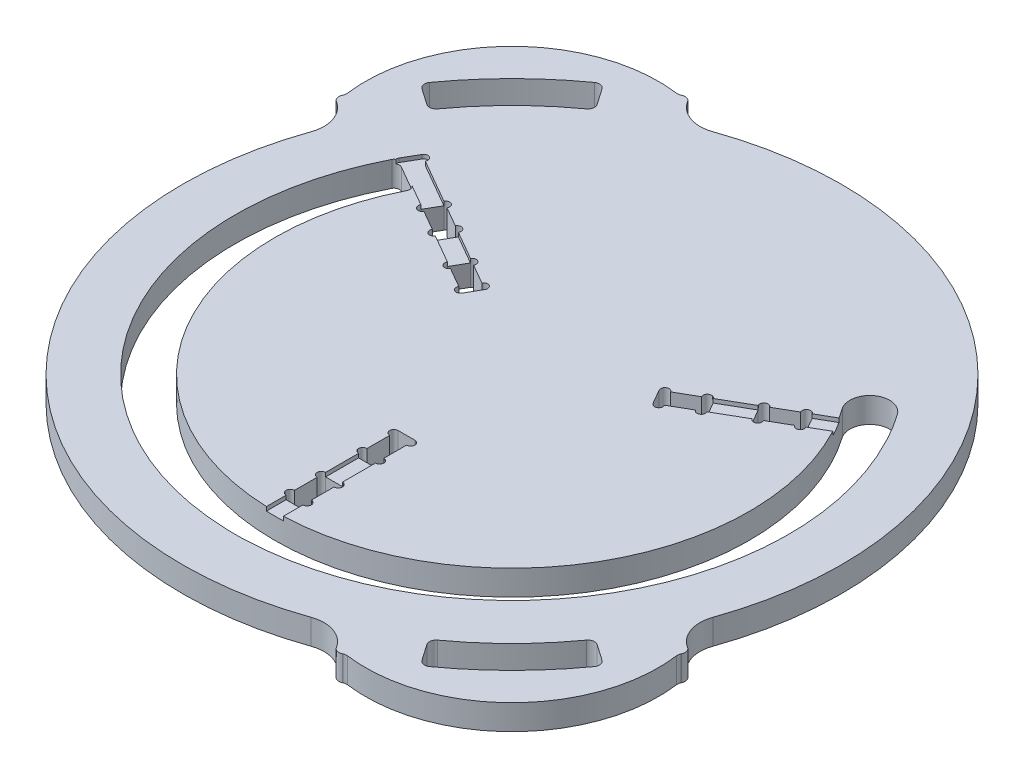
from build123d import *

# Parameters (mm, degrees)
BOSS_EXTRUDE1_DEPTH = 19.05
FILLET1_R           = 4
FILLET2_R           = 5
FILLET3_R           = 25
CUT_EXTRUDE1_DEPTH  = 355.066240418
CIRPATTERN1_COUNT   = 3
CUT_EXTRUDE2_DEPTH  = 3
CIRPATTERN2_COUNT   = 3


with BuildPart() as part:
    # Sketch1 → Boss-Extrude1 (new body)
    with BuildSketch(Plane(origin=(0, 0, 0), x_dir=(1, 0, 0), z_dir=(0, 1, 0))):
        with BuildLine():
            Line((-227.272727273, 104.149447613), (-250, 114.564392374))
            ThreePointArc((-250, 114.564392374), (-248.532464969, 117.714119188), (-247.02524875, 120.845051532))
            ThreePointArc((-247.02524875, 120.845051532), (-215.667568262, 215.667568262), (-120.845051532, 247.02524875))
            ThreePointArc((-120.845051532, 247.02524875), (-117.714119188, 248.532464969), (-114.564392374, 250))
            Line((-114.564392374, 250), (-104.149447613, 227.272727273))
            ThreePointArc((-104.149447613, 227.272727273), (176.776695297, 176.776695297), (227.272727273, -104.149447613))
            Line((227.272727273, -104.149447613), (250, -114.564392374))
            ThreePointArc((250, -114.564392374), (248.532464969, -117.714119188), (247.02524875, -120.845051532))
            ThreePointArc((247.02524875, -120.845051532), (215.667568262, -215.667568262), (120.845051532, -247.02524875))
            ThreePointArc((120.845051532, -247.02524875), (117.714119188, -248.532464969), (114.564392374, -250))
            Line((114.564392374, -250), (104.149447613, -227.272727273))
            ThreePointArc((104.149447613, -227.272727273), (-176.776695297, -176.776695297), (-227.272727273, 104.149447613))
        make_face()
        with BuildLine():
            Line((-184.957172187, 99.452724732), (-158.962541623, 84.444717779))
            ThreePointArc((-158.962541623, 84.444717779), (11.354398907, -179.641525337), (147.065162732, 103.787465094))
            ThreePointArc((147.065162732, 103.787465094), (152.575062256, 124.350690065), (173.138287227, 118.84079054))
            ThreePointArc((173.138287227, 118.84079054), (11.353227927, -209.692880698), (-184.957172187, 99.452724732))
        make_face(mode=Mode.SUBTRACT)
        with BuildLine():
            Line((-226.125782355, 156.499618384), (-205.56889305, 142.272380349))
            ThreePointArc((-205.56889305, 142.272380349), (-191.949665719, 160.172799908), (-176.776695297, 176.776695297))
            ThreePointArc((-176.776695297, 176.776695297), (-160.172799908, 191.949665719), (-142.272380349, 205.56889305))
            Line((-142.272380349, 205.56889305), (-156.499618384, 226.125782355))
            ThreePointArc((-156.499618384, 226.125782355), (-194.454364826, 194.454364826), (-226.125782355, 156.499618384))
        make_face(mode=Mode.SUBTRACT)
        with BuildLine():
            Line((156.499618384, -226.125782355), (142.272380349, -205.56889305))
            ThreePointArc((142.272380349, -205.56889305), (160.172799908, -191.949665719), (176.776695297, -176.776695297))
            ThreePointArc((176.776695297, -176.776695297), (191.949665719, -160.172799908), (205.56889305, -142.272380349))
            Line((205.56889305, -142.272380349), (226.125782355, -156.499618384))
            ThreePointArc((226.125782355, -156.499618384), (194.454364826, -194.454364826), (156.499618384, -226.125782355))
        make_face(mode=Mode.SUBTRACT)
    extrude(amount=BOSS_EXTRUDE1_DEPTH)

    # Fillet1
    fillet1_edges = [part.edges().sort_by_distance(p)[0] for p in [
        (-158.962541623, 9.525, -84.444717779),
        (-184.957172187, 9.525, -99.452724732),
    ]]
    fillet(fillet1_edges, radius=FILLET1_R)

    # Fillet2
    fillet2_edges = [part.edges().sort_by_distance(p)[0] for p in [
        (-114.564392374, 9.525, -250),
        (250, 9.525, 114.564392374),
        (247.02524875, 9.525, 120.845051532),
        (120.845051532, 9.525, 247.02524875),
        (114.564392374, 9.525, 250),
        (-250, 9.525, -114.564392374),
        (-247.02524875, 9.525, -120.845051532),
        (-120.845051532, 9.525, -247.02524875),
        (-205.56889305, 9.525, -142.272380349),
        (-142.272380349, 9.525, -205.56889305),
        (-156.499618384, 9.525, -226.125782355),
        (-226.125782355, 9.525, -156.499618384),
        (205.56889305, 9.525, 142.272380349),
        (142.272380349, 9.525, 205.56889305),
        (156.499618384, 9.525, 226.125782355),
        (226.125782355, 9.525, 156.499618384),
    ]]
    fillet(fillet2_edges, radius=FILLET2_R)

    # Fillet3
    fillet3_edges = [part.edges().sort_by_distance(p)[0] for p in [
        (-104.149447613, 9.525, -227.272727273),
        (-227.272727273, 9.525, -104.149447613),
        (104.149447613, 9.525, 227.272727273),
        (227.272727273, 9.525, 104.149447613),
    ]]
    fillet(fillet3_edges, radius=FILLET3_R)

    # Sketch3 → Cut-Extrude1 (cut, through all)
    with BuildSketch(Plane(origin=(0, 19.05, 0), x_dir=(1, 0, 0), z_dir=(0, 1, 0))):
        with BuildLine():
            Line((-6.4, -135), (6.4, -135))
            ThreePointArc((6.4, -135), (9.6, -138.2), (6.4, -141.4))
            Line((6.4, -141.4), (6.4, -158.6))
            ThreePointArc((6.4, -158.6), (9.6, -161.8), (6.4, -165))
            Line((6.4, -165), (-6.4, -165))
            ThreePointArc((-6.4, -165), (-9.6, -161.8), (-6.4, -158.6))
            Line((-6.4, -158.6), (-6.4, -141.4))
            ThreePointArc((-6.4, -141.4), (-9.6, -138.2), (-6.4, -135))
        make_face()
        with BuildLine():
            Line((-6.4, -80), (6.4, -80))
            ThreePointArc((6.4, -80), (9.6, -83.2), (6.4, -86.4))
            Line((6.4, -86.4), (6.4, -103.6))
            ThreePointArc((6.4, -103.6), (9.6, -106.8), (6.4, -110))
            Line((6.4, -110), (-6.4, -110))
            ThreePointArc((-6.4, -110), (-9.6, -106.8), (-6.4, -103.6))
            Line((-6.4, -103.6), (-6.4, -86.4))
            ThreePointArc((-6.4, -86.4), (-9.6, -83.2), (-6.4, -80))
        make_face()
    cut_extrude1 = extrude(amount=-CUT_EXTRUDE1_DEPTH, mode=Mode.SUBTRACT)

    # CirPattern1: Cut-Extrude1 ×3 about axis
    cirpattern1_axis = Axis((0, 0, 0), (0, 1, 0))
    for i in range(1, CIRPATTERN1_COUNT):
        add(cut_extrude1.rotate(cirpattern1_axis, i * 360 / CIRPATTERN1_COUNT), mode=Mode.SUBTRACT)

    # Sketch4 → Cut-Extrude2 (cut)
    with BuildSketch(Plane(origin=(0, 19.05, 0), x_dir=(1, 0, 0), z_dir=(0, 1, 0))):
        with BuildLine():
            Line((185.065334795, 99.457437416), (178.665334795, 110.542562584))
            ThreePointArc((178.665334795, 110.542562584), (174.294053503, 111.713843876), (173.122772211, 107.342562584))
            Line((173.122772211, 107.342562584), (66.082032303, 45.542562584))
            Line((66.082032303, 45.542562584), (72.482032303, 34.457437416))
            Line((72.482032303, 34.457437416), (179.522772211, 96.257437416))
            ThreePointArc((179.522772211, 96.257437416), (183.894053503, 95.086156124), (185.065334795, 99.457437416))
        make_face()
    cut_extrude2 = extrude(amount=-CUT_EXTRUDE2_DEPTH, mode=Mode.SUBTRACT)

    # CirPattern2: Cut-Extrude2 ×3 about axis
    cirpattern2_axis = Axis((0, 0, 0), (0, 1, 0))
    for i in range(1, CIRPATTERN2_COUNT):
        add(cut_extrude2.rotate(cirpattern2_axis, i * 360 / CIRPATTERN2_COUNT), mode=Mode.SUBTRACT)


solid = part.part
